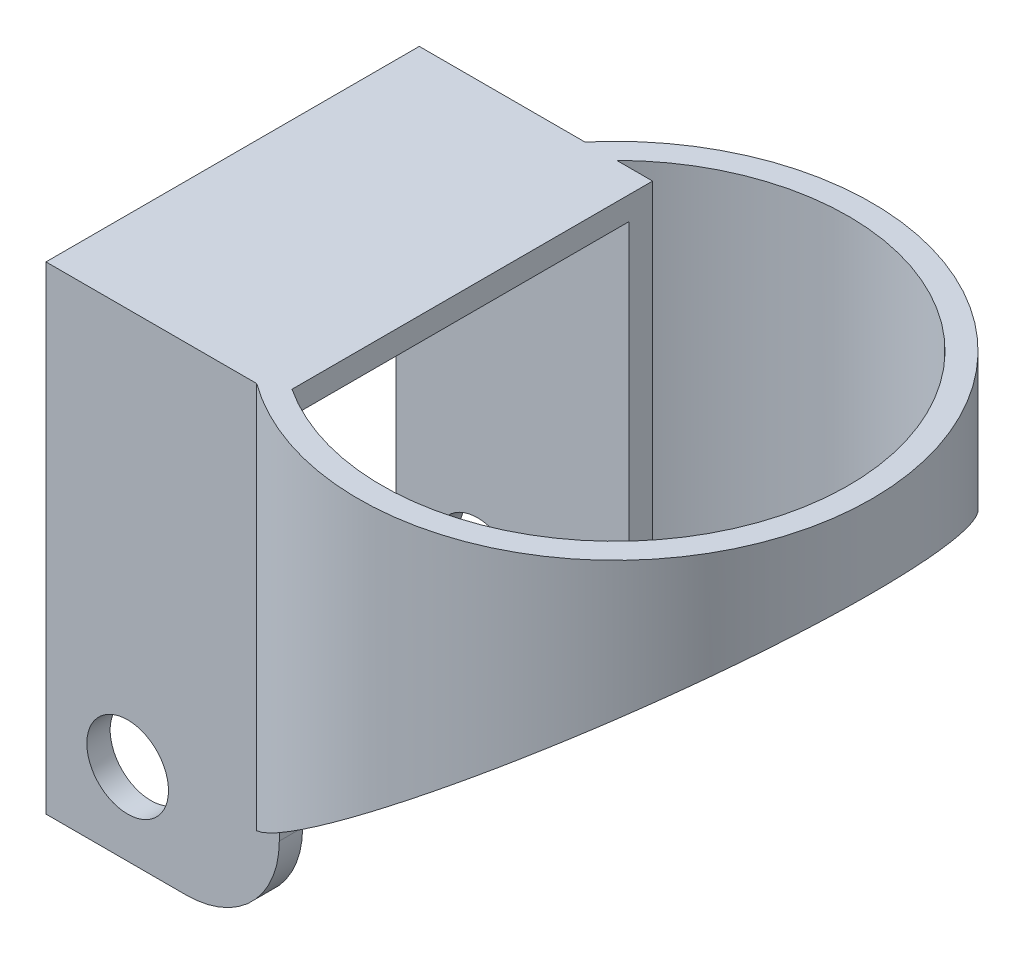
from build123d import *

# Parameters (mm, degrees)
SKETCH1_R               = 22
SKETCH1_R_2             = 20
BOSS_EXTRUDE1_DEPTH     = 40
CUT_EXTRUDE1_DEPTH      = 51.675437837
CUT_EXTRUDE1_DEPTH_BACK = 51.675437837
BOSS_EXTRUDE2_DEPTH     = 20
SKETCH4_W               = 28
SKETCH4_H               = 39
CUT_EXTRUDE2_DEPTH      = 56.181518645
CUT_EXTRUDE3_DEPTH      = 63.225573619
CUT_EXTRUDE3_DEPTH_BACK = 63.225573619
SKETCH5_R               = 3.5
FILLET1_R               = 8


with BuildPart() as part:
    # Sketch1 → Boss-Extrude1 (new body)
    with BuildSketch(Plane(origin=(0, 0, 0), x_dir=(1, 0, 0), z_dir=(0, 1, 0))):
        with Locations(Location((0, 0, 0), (0, 0, 270))):
            Circle(SKETCH1_R)
        with Locations(Location((0, 0, 0), (0, 0, 270))):
            Circle(SKETCH1_R_2, mode=Mode.SUBTRACT)
    extrude(amount=BOSS_EXTRUDE1_DEPTH)

    # Sketch2 → Cut-Extrude1 (cut, two sides: drawn at the far end of the back side and taken through both)
    with BuildSketch(Plane.XY.offset(-CUT_EXTRUDE1_DEPTH_BACK)):
        Polygon((22, 33), (-22, 0), (22, 0), align=None)
    extrude(amount=CUT_EXTRUDE1_DEPTH + CUT_EXTRUDE1_DEPTH_BACK, mode=Mode.SUBTRACT)

    # Sketch3 → Boss-Extrude2 (add)
    with BuildSketch(Plane(origin=(-31, 0, 0), x_dir=(0, 0, -1), z_dir=(1, 0, 0))):
        Polygon((14.20803795, 40), (-17.79196205, 40), (-17.79196205, -1), (-15.79196205, -1), (-15.79196205, 1), (-15.79196205, 38), (12.20803795, 38), (12.20803795, 1), (12.20803795, -1), (14.20803795, -1), align=None)
    extrude(amount=BOSS_EXTRUDE2_DEPTH)

    # Sketch4 → Cut-Extrude2 (cut, through all)
    with BuildSketch(Plane(origin=(0, 0, 0), x_dir=(0, 0, -1), z_dir=(1, 0, 0))):
        with Locations((-1.79196205, 18.5)):
            Rectangle(SKETCH4_W, SKETCH4_H)
    extrude(amount=-CUT_EXTRUDE2_DEPTH, mode=Mode.SUBTRACT)

    # Sketch5 → Cut-Extrude3 (cut, two sides: drawn at the far end of the back side and taken through both)
    with BuildSketch(Plane(origin=(0, 0, -14.20803795), x_dir=(-1, 0, 0), z_dir=(0, 0, -1)).offset(-CUT_EXTRUDE3_DEPTH_BACK)):
        with Locations((24, 6)):
            Circle(SKETCH5_R)
    extrude(amount=CUT_EXTRUDE3_DEPTH + CUT_EXTRUDE3_DEPTH_BACK, mode=Mode.SUBTRACT)

    # Fillet1
    fillet1_edges = [part.edges().sort_by_distance(p)[0] for p in [
        (-11, -1, 16.79196205),
        (-11, -1, -13.20803795),
    ]]
    fillet(fillet1_edges, radius=FILLET1_R)


solid = part.part
